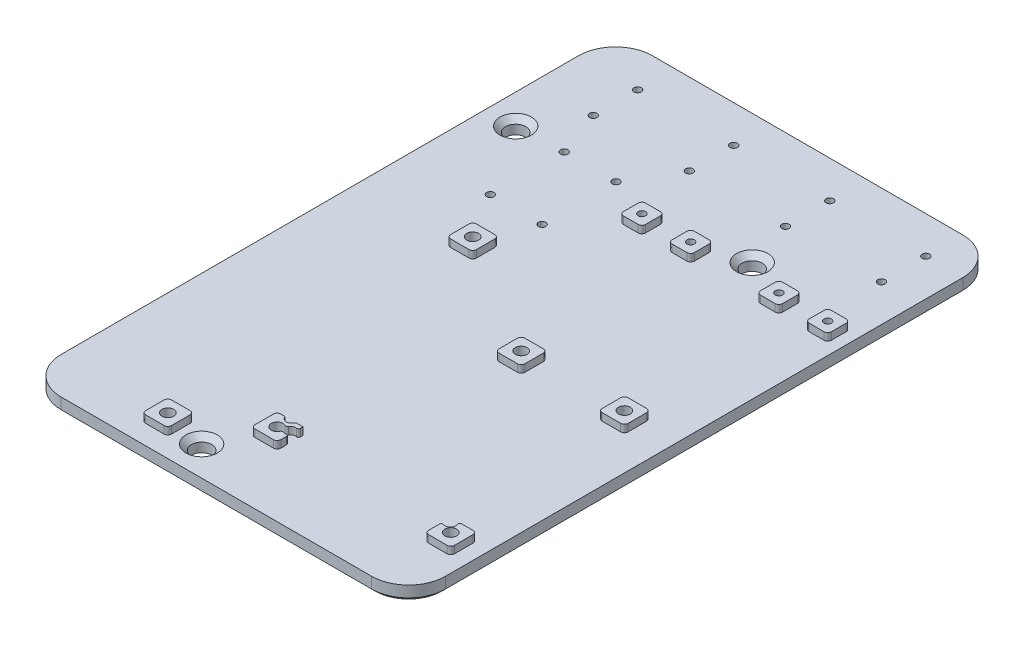
from build123d import *

# Parameters (mm, degrees)
SKETCH1_W            = 104
SKETCH1_H            = 160
SKETCH1_R            = 1
SKETCH1_R_2          = 1.6
BOSS_EXTRUDE1_DEPTH  = 4
BOSS_EXTRUDE2_START  = -2
SKETCH2_W            = 7
SKETCH2_H            = 7
SKETCH2_R            = 1.6
SKETCH2_W_2          = 6
SKETCH2_H_2          = 6
SKETCH2_R_2          = 1
BOSS_EXTRUDE2_DEPTH  = 2
SKETCH3_R            = 1.4
CUT_EXTRUDE1_DEPTH   = 2
FILLET1_R            = 0.5
FILLET2_R            = 1
CUT_EXTRUDE2_DEPTH   = 2.4
SKETCH5_R            = 2.75
CUT_EXTRUDE3_DEPTH   = 184.961952726
CHAMFER1_SIZE        = 1.5
FILLET3_R            = 10
SKETCH6_R            = 1
CUT_EXTRUDE4_DEPTH   = 184.961952726
LPATTERN1_COUNT      = 4
LPATTERN1_PITCH      = 26
LPATTERN1_COUNT_DIR2 = 2
LPATTERN1_PITCH_DIR2 = 12
SKETCH7_R            = 1
CUT_EXTRUDE5_DEPTH   = 184.961952726
CHAMFER2_SIZE        = 1


with BuildPart() as part:
    # Sketch1 → Boss-Extrude1 (new body)
    with BuildSketch(Plane(origin=(0, 0, 0), x_dir=(1, 0, 0), z_dir=(0, 1, 0))):
        with Locations((-47, 75)):
            Rectangle(SKETCH1_W, SKETCH1_H)
        with Locations(Location((-1.09, 114.53, 0), (0, 0, 270))):
            Circle(SKETCH1_R, mode=Mode.SUBTRACT)
        with Locations(Location((-14.29, 114.53, 0), (0, 0, 270))):
            Circle(SKETCH1_R, mode=Mode.SUBTRACT)
        with Locations(Location((-38.19, 114.53, 0), (0, 0, 270))):
            Circle(SKETCH1_R, mode=Mode.SUBTRACT)
        with Locations(Location((-51.39, 114.53, 0), (0, 0, 270))):
            Circle(SKETCH1_R, mode=Mode.SUBTRACT)
        with Locations(Location((-68.89, 86.25, 0), (0, 0, 270))):
            Circle(SKETCH1_R_2, mode=Mode.SUBTRACT)
        with Locations(Location((-68.89, 3.75, 0), (0, 0, 270))):
            Circle(SKETCH1_R_2, mode=Mode.SUBTRACT)
        with Locations(Location((-50.8, 15.24, 0), (0, 0, 270))):
            Circle(SKETCH1_R_2, mode=Mode.SUBTRACT)
        with Locations(Location((-2.54, 13.97, 0), (0, 0, 270))):
            Circle(SKETCH1_R_2, mode=Mode.SUBTRACT)
        with Locations(Location((-7.62, 66.04, 0), (0, 0, 270))):
            Circle(SKETCH1_R_2, mode=Mode.SUBTRACT)
        with Locations(Location((-35.56, 66.04, 0), (0, 0, 270))):
            Circle(SKETCH1_R_2, mode=Mode.SUBTRACT)
    extrude(amount=-BOSS_EXTRUDE1_DEPTH)

    # Sketch2 → Boss-Extrude2 (add)
    # profile 1 of 10: a face of its own
    with BuildSketch(Plane(origin=(0, 0, 0), x_dir=(-1, 0, 0), z_dir=(0, -1, 0)).offset(BOSS_EXTRUDE2_START)):
        with Locations((68.89, 3.75)):
            Rectangle(SKETCH2_W, SKETCH2_H)
        with Locations(Location((68.89, 3.75, 0), (0, 0, 270))):
            Circle(SKETCH2_R, mode=Mode.SUBTRACT)
    # profile 2 of 10: a face of its own
    with BuildSketch(Plane(origin=(0, 0, 0), x_dir=(-1, 0, 0), z_dir=(0, -1, 0)).offset(BOSS_EXTRUDE2_START)):
        with Locations((68.89, 86.25)):
            Rectangle(SKETCH2_W, SKETCH2_H)
        with Locations(Location((68.89, 86.25, 0), (0, 0, 270))):
            Circle(SKETCH2_R, mode=Mode.SUBTRACT)
    # profile 3 of 10: a face of its own
    with BuildSketch(Plane(origin=(0, 0, 0), x_dir=(-1, 0, 0), z_dir=(0, -1, 0)).offset(BOSS_EXTRUDE2_START)):
        with Locations((51.39, 114.53)):
            Rectangle(SKETCH2_W_2, SKETCH2_H_2)
        with Locations(Location((51.39, 114.53, 0), (0, 0, 270))):
            Circle(SKETCH2_R_2, mode=Mode.SUBTRACT)
    # profile 4 of 10: a face of its own
    with BuildSketch(Plane(origin=(0, 0, 0), x_dir=(-1, 0, 0), z_dir=(0, -1, 0)).offset(BOSS_EXTRUDE2_START)):
        with Locations((38.19, 114.53)):
            Rectangle(SKETCH2_W_2, SKETCH2_H_2)
        with Locations(Location((38.19, 114.53, 0), (0, 0, 270))):
            Circle(SKETCH2_R_2, mode=Mode.SUBTRACT)
    # profile 5 of 10: a face of its own
    with BuildSketch(Plane(origin=(0, 0, 0), x_dir=(-1, 0, 0), z_dir=(0, -1, 0)).offset(BOSS_EXTRUDE2_START)):
        with Locations((14.29, 114.53)):
            Rectangle(SKETCH2_W_2, SKETCH2_H_2)
        with Locations(Location((14.29, 114.53, 0), (0, 0, 270))):
            Circle(SKETCH2_R_2, mode=Mode.SUBTRACT)
    # profile 6 of 10: a face of its own
    with BuildSketch(Plane(origin=(0, 0, 0), x_dir=(-1, 0, 0), z_dir=(0, -1, 0)).offset(BOSS_EXTRUDE2_START)):
        with Locations((1.09, 114.53)):
            Rectangle(SKETCH2_W_2, SKETCH2_H_2)
        with Locations(Location((1.09, 114.53, 0), (0, 0, 270))):
            Circle(SKETCH2_R_2, mode=Mode.SUBTRACT)
    # profile 7 of 10: a face of its own
    with BuildSketch(Plane(origin=(0, 0, 0), x_dir=(-1, 0, 0), z_dir=(0, -1, 0)).offset(BOSS_EXTRUDE2_START)):
        with Locations((2.54, 13.97)):
            Rectangle(SKETCH2_W, SKETCH2_H)
        with Locations(Location((2.54, 13.97, 0), (0, 0, 270))):
            Circle(SKETCH2_R, mode=Mode.SUBTRACT)
    # profile 8 of 10: a face of its own
    with BuildSketch(Plane(origin=(0, 0, 0), x_dir=(-1, 0, 0), z_dir=(0, -1, 0)).offset(BOSS_EXTRUDE2_START)):
        with Locations((50.8, 15.24)):
            Rectangle(SKETCH2_W, SKETCH2_H)
        with Locations(Location((50.8, 15.24, 0), (0, 0, 270))):
            Circle(SKETCH2_R, mode=Mode.SUBTRACT)
    # profile 9 of 10: a face of its own
    with BuildSketch(Plane(origin=(0, 0, 0), x_dir=(-1, 0, 0), z_dir=(0, -1, 0)).offset(BOSS_EXTRUDE2_START)):
        with Locations((35.56, 66.04)):
            Rectangle(SKETCH2_W, SKETCH2_H)
        with Locations(Location((35.56, 66.04, 0), (0, 0, 270))):
            Circle(SKETCH2_R, mode=Mode.SUBTRACT)
    # profile 10 of 10: a face of its own
    with BuildSketch(Plane(origin=(0, 0, 0), x_dir=(-1, 0, 0), z_dir=(0, -1, 0)).offset(BOSS_EXTRUDE2_START)):
        with Locations((7.62, 66.04)):
            Rectangle(SKETCH2_W, SKETCH2_H)
        with Locations(Location((7.62, 66.04, 0), (0, 0, 270))):
            Circle(SKETCH2_R, mode=Mode.SUBTRACT)
    extrude(amount=BOSS_EXTRUDE2_DEPTH)

    # Sketch3 → Cut-Extrude1 (cut)
    with BuildSketch(Plane(origin=(0, 2, 0), x_dir=(1, 0, 0), z_dir=(0, 1, 0))):
        with Locations((-50.718330126, 19.042444873)):
            Circle(SKETCH3_R)
        with Locations((-48.170153701, 16.151905809)):
            Circle(SKETCH3_R)
        with BuildLine():
            Line((-5.836267317, 15.161956315), (-7.836267317, 17.161956315))
            ThreePointArc((-7.836267317, 17.161956315), (-7.836267317, 19.141855302), (-5.856368329, 19.141855302))
            Line((-5.856368329, 19.141855302), (-3.856368329, 17.141855302))
            ThreePointArc((-3.856368329, 17.141855302), (-3.856368329, 15.161956315), (-5.836267317, 15.161956315))
        make_face()
    extrude(amount=-CUT_EXTRUDE1_DEPTH, mode=Mode.SUBTRACT)

    # Fillet1
    fillet1_edges = [part.edges().sort_by_distance(p)[0] for p in [
        (-52.085270907, 1, -18.74),
        (-49.351389345, 1, -18.74),
        (-47.3, 1, -17.248643032),
        (-47.3, 1, -15.055168585),
        (-49.566085594, 1, -16.258555466),
        (-49.200405709, 1, -15.20397079),
        (-6.04, 1, -15.365688999),
        (-4.184513027, 1, -17.47),
    ]]
    fillet(fillet1_edges, radius=FILLET1_R)

    # Fillet2
    fillet2_edges = [part.edges().sort_by_distance(p)[0] for p in [
        (-17.29, 1, -117.53),
        (-17.29, 1, -111.53),
        (-11.29, 1, -111.53),
        (-11.29, 1, -117.53),
        (1.91, 1, -111.53),
        (1.91, 1, -117.53),
        (-4.09, 1, -117.53),
        (-4.09, 1, -111.53),
        (-6.04, 1, -10.47),
        (0.96, 1, -10.47),
        (0.96, 1, -17.47),
        (-47.3, 1, -11.74),
        (-54.3, 1, -18.74),
        (-54.3, 1, -11.74),
        (-39.06, 1, -69.54),
        (-39.06, 1, -62.54),
        (-32.06, 1, -62.54),
        (-32.06, 1, -69.54),
        (-11.12, 1, -69.54),
        (-11.12, 1, -62.54),
        (-4.12, 1, -62.54),
        (-4.12, 1, -69.54),
        (-72.39, 1, -7.25),
        (-72.39, 1, -0.25),
        (-65.39, 1, -0.25),
        (-65.39, 1, -7.25),
        (-72.39, 1, -89.75),
        (-72.39, 1, -82.75),
        (-65.39, 1, -82.75),
        (-65.39, 1, -89.75),
        (-54.39, 1, -117.53),
        (-54.39, 1, -111.53),
        (-48.39, 1, -111.53),
        (-48.39, 1, -117.53),
        (-35.19, 1, -111.53),
        (-35.19, 1, -117.53),
        (-41.19, 1, -117.53),
        (-41.19, 1, -111.53),
    ]]
    fillet(fillet2_edges, radius=FILLET2_R)

    # Sketch4 → Cut-Extrude2 (cut)
    with BuildSketch(Plane.XZ.offset(4)):
        Polygon((-32.326838493, -66.04), (-33.943419246, -63.24), (-37.176580754, -63.24), (-38.793161507, -66.04), (-37.176580754, -68.84), (-33.943419246, -68.84), align=None)
        Polygon((-4.386838493, -66.04), (-6.003419246, -63.24), (-9.236580754, -63.24), (-10.853161507, -66.04), (-9.236580754, -68.84), (-6.003419246, -68.84), align=None)
        Polygon((-65.656838493, -86.25), (-67.273419246, -83.45), (-70.506580754, -83.45), (-72.123161507, -86.25), (-70.506580754, -89.05), (-67.273419246, -89.05), align=None)
        Polygon((0.693161507, -13.97), (-0.923419246, -11.17), (-4.156580754, -11.17), (-5.773161507, -13.97), (-4.156580754, -16.77), (-0.923419246, -16.77), align=None)
        Polygon((-47.566838493, -15.24), (-49.183419246, -12.44), (-52.416580754, -12.44), (-54.033161507, -15.24), (-52.416580754, -18.04), (-49.183419246, -18.04), align=None)
        Polygon((-65.656838493, -3.75), (-67.273419246, -0.95), (-70.506580754, -0.95), (-72.123161507, -3.75), (-70.506580754, -6.55), (-67.273419246, -6.55), align=None)
    extrude(amount=-CUT_EXTRUDE2_DEPTH, mode=Mode.SUBTRACT)

    # Sketch5 → Cut-Extrude3 (cut, through all)
    with BuildSketch(Plane(origin=(0, 0, 0), x_dir=(1, 0, 0), z_dir=(0, 1, 0))):
        with Locations(Location((-59, 3, 0), (0, 0, 270))):
            Circle(SKETCH5_R)
        with Locations(Location((-91, 120, 0), (0, 0, 270))):
            Circle(SKETCH5_R)
        with Locations(Location((-27, 120, 0), (0, 0, 270))):
            Circle(SKETCH5_R)
    extrude(amount=-CUT_EXTRUDE3_DEPTH, mode=Mode.SUBTRACT)

    # Chamfer1
    chamfer1_edges = [part.edges().sort_by_distance(p)[0] for p in [
        (-59, 0, -5.75),
        (-27, 0, -122.75),
        (-91, 0, -122.75),
    ]]
    chamfer(chamfer1_edges, length=CHAMFER1_SIZE)

    # Fillet3
    fillet3_edges = [part.edges().sort_by_distance(p)[0] for p in [
        (5, -2, 5),
        (-99, -2, 5),
        (-99, -2, -155),
        (5, -2, -155),
    ]]
    fillet(fillet3_edges, radius=FILLET3_R)

    # Sketch6 → Cut-Extrude4 (cut, through all)
    with BuildSketch(Plane(origin=(0, 0, 0), x_dir=(1, 0, 0), z_dir=(0, 1, 0))):
        with Locations(Location((-5, 145, 0), (0, 0, 270))):
            Circle(SKETCH6_R)
    cut_extrude4 = extrude(amount=-CUT_EXTRUDE4_DEPTH, mode=Mode.SUBTRACT)

    # LPattern1: Cut-Extrude4 4 × 2
    with Locations(*[(-i * LPATTERN1_PITCH, 0, j * LPATTERN1_PITCH_DIR2) for i in range(LPATTERN1_COUNT) for j in range(LPATTERN1_COUNT_DIR2) if (i, j) != (0, 0)]):
        add(cut_extrude4, mode=Mode.SUBTRACT)

    # Sketch7 → Cut-Extrude5 (cut, through all)
    with BuildSketch(Plane(origin=(0, 0, 0), x_dir=(1, 0, 0), z_dir=(0, 1, 0))):
        with Locations(Location((-78.39, 120.53, 0), (0, 0, 270))):
            Circle(SKETCH7_R)
        with Locations(Location((-64.39, 120.53, 0), (0, 0, 270))):
            Circle(SKETCH7_R)
        with Locations(Location((-78.39, 100.53, 0), (0, 0, 270))):
            Circle(SKETCH7_R)
        with Locations(Location((-64.39, 100.53, 0), (0, 0, 270))):
            Circle(SKETCH7_R)
    extrude(amount=-CUT_EXTRUDE5_DEPTH, mode=Mode.SUBTRACT)

    # Chamfer2
    chamfer2_edges = [part.edges().sort_by_distance(p)[0] for p in [
        (-47, -4, -155),
        (-99, -4, -75),
        (5, -4, -75),
        (-47, -4, 5),
        (2.071067812, -4, 2.071067812),
        (-96.071067812, -4, 2.071067812),
        (2.071067812, -4, -152.071067812),
        (-96.071067812, -4, -152.071067812),
    ]]
    chamfer(chamfer2_edges, length=CHAMFER2_SIZE)


solid = part.part
